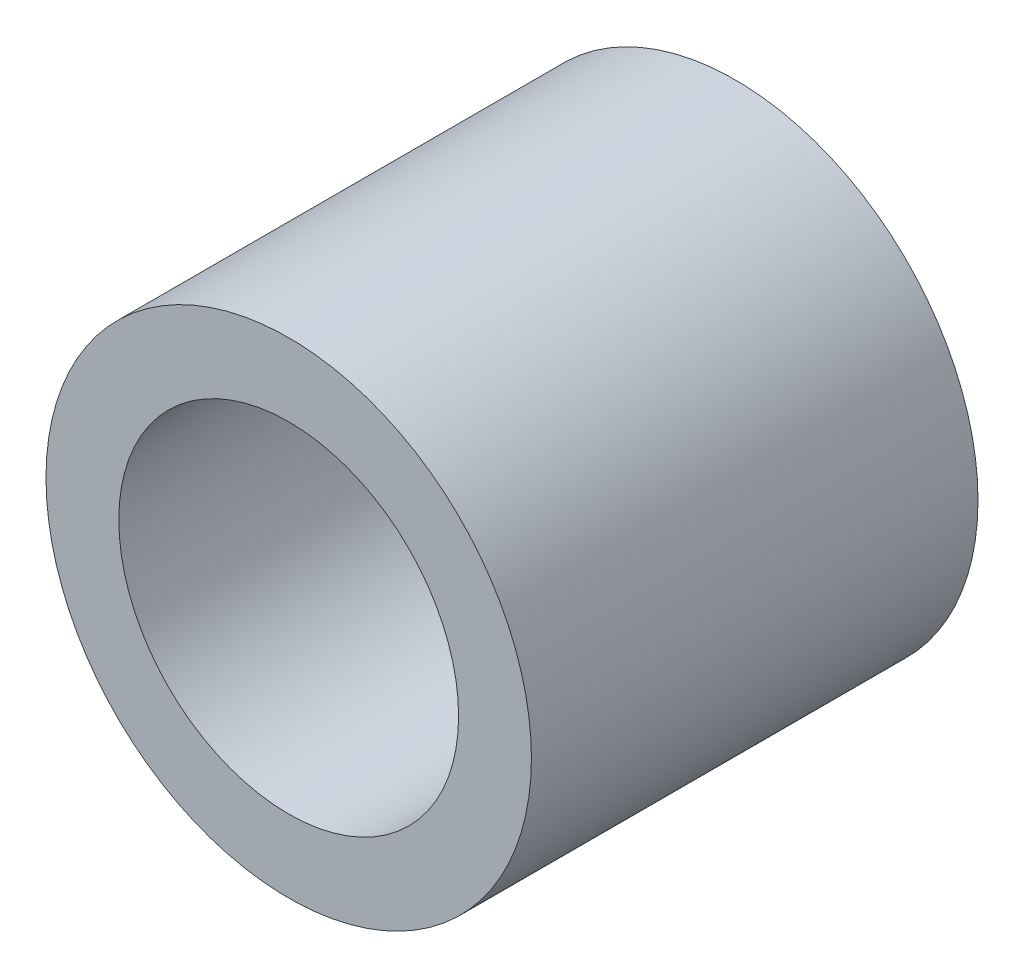
from build123d import *

# Parameters (mm, degrees)
SKETCH_1_R      = 2.5
SKETCH_1_R_2    = 1.75
EXTRUDE_1_DEPTH = 4.6


with BuildPart() as part:
    # 草图1 → 凸台-拉伸1 (new body)
    with BuildSketch(Plane.XY):
        Circle(SKETCH_1_R)
        Circle(SKETCH_1_R_2, mode=Mode.SUBTRACT)
    extrude(amount=EXTRUDE_1_DEPTH)


solid = part.part
